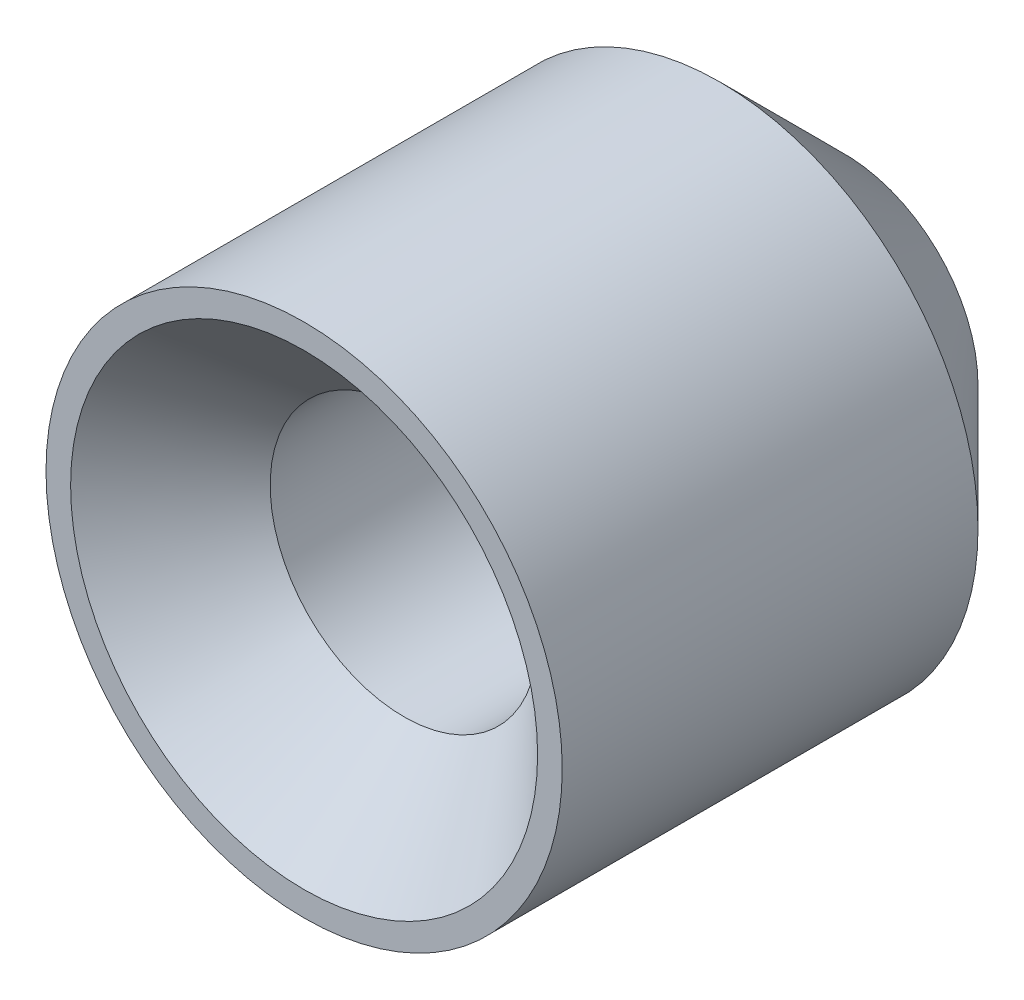
from build123d import *

# Parameters (mm, degrees)
SKETCH1_R                         = 4.9276
BOSS_EXTRUDE1_DEPTH               = 7.9375
SKETCH4_R                         = 4.9276
BOSS_EXTRUDE2_DEPTH               = 3.175
BOSS_EXTRUDE2_TAPER               = 45
F_1_4_20_TAPPED_HOLE1_D           = 5.1054
F_1_4_20_TAPPED_HOLE1_DEPTH       = 16.51
F_1_4_20_TAPPED_HOLE1_CSINK_D     = 8.9154
F_1_4_20_TAPPED_HOLE1_CSINK_ANGLE = 90
F_1_4_20_TAPPED_HOLE1_TIP         = 1.533816902


with BuildPart() as part:
    # Sketch1 → Boss-Extrude1 (new body)
    with BuildSketch(Plane.XY):
        with Locations((-11.193990041, 3.085910768)):
            Circle(SKETCH1_R)
    extrude(amount=BOSS_EXTRUDE1_DEPTH)

    # Sketch4 → Boss-Extrude2 (add)
    with BuildSketch(Plane(origin=(0, 0, 0), x_dir=(-1, 0, 0), z_dir=(0, 0, -1))):
        with Locations((11.193990041, 3.085910768)):
            Circle(SKETCH4_R)
    extrude(amount=BOSS_EXTRUDE2_DEPTH, taper=BOSS_EXTRUDE2_TAPER)

    # 1/4-20 Tapped Hole1
    with Locations(Plane.XY.offset(7.9375)):
        with Locations((-11.193990041, 3.085910768)):
            CounterSinkHole(F_1_4_20_TAPPED_HOLE1_D / 2, F_1_4_20_TAPPED_HOLE1_CSINK_D / 2, depth=F_1_4_20_TAPPED_HOLE1_DEPTH, counter_sink_angle=F_1_4_20_TAPPED_HOLE1_CSINK_ANGLE)
            with Locations((0, 0, -(F_1_4_20_TAPPED_HOLE1_DEPTH + F_1_4_20_TAPPED_HOLE1_TIP / 2))):  # 118° drill point
                Cone(0, F_1_4_20_TAPPED_HOLE1_D / 2, F_1_4_20_TAPPED_HOLE1_TIP, mode=Mode.SUBTRACT)


solid = part.part
